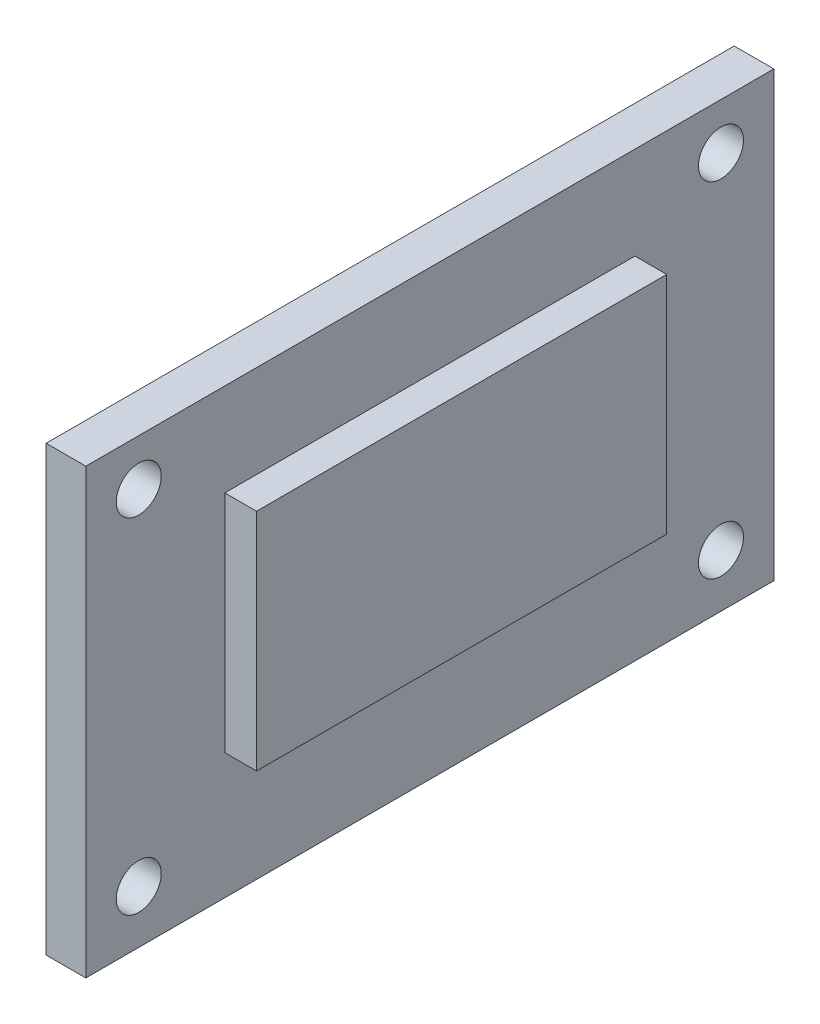
from build123d import *

# Parameters (mm, degrees)
SKETCH1_W           = 52
SKETCH1_H           = 33.5
COVER_PLATE_DEPTH   = 3
SKETCH2_W           = 31
SKETCH2_H           = 17
LOCATING_PLUG_DEPTH = 2.41
SKETCH3_R           = 1.7
SCREW_HOLES_DEPTH   = 5


with BuildPart() as part:
    # Sketch1 → Cover Plate (new body)
    with BuildSketch(Plane(origin=(-75.4, 0, 0), x_dir=(0, 0, -1), z_dir=(1, 0, 0))):
        with Locations((-64, -10.25)):
            Rectangle(SKETCH1_W, SKETCH1_H)
    extrude(amount=COVER_PLATE_DEPTH)

    # Sketch2 → Locating Plug (add)
    with BuildSketch(Plane(origin=(-72.41, 0, 0), x_dir=(0, 0, -1), z_dir=(1, 0, 0))):
        with Locations((-64, -9)):
            Rectangle(SKETCH2_W, SKETCH2_H)
    extrude(amount=LOCATING_PLUG_DEPTH)

    # Sketch3 → Screw Holes (cut)
    with BuildSketch(Plane(origin=(-76.4, 0, 0), x_dir=(0, 0, -1), z_dir=(1, 0, 0))):
        with Locations((-86, -23)):
            Circle(SKETCH3_R)
        with Locations((-86, 3)):
            Circle(SKETCH3_R)
        with Locations((-42, -23)):
            Circle(SKETCH3_R)
        with Locations((-42, 3)):
            Circle(SKETCH3_R)
    extrude(amount=SCREW_HOLES_DEPTH, mode=Mode.SUBTRACT)


solid = part.part
